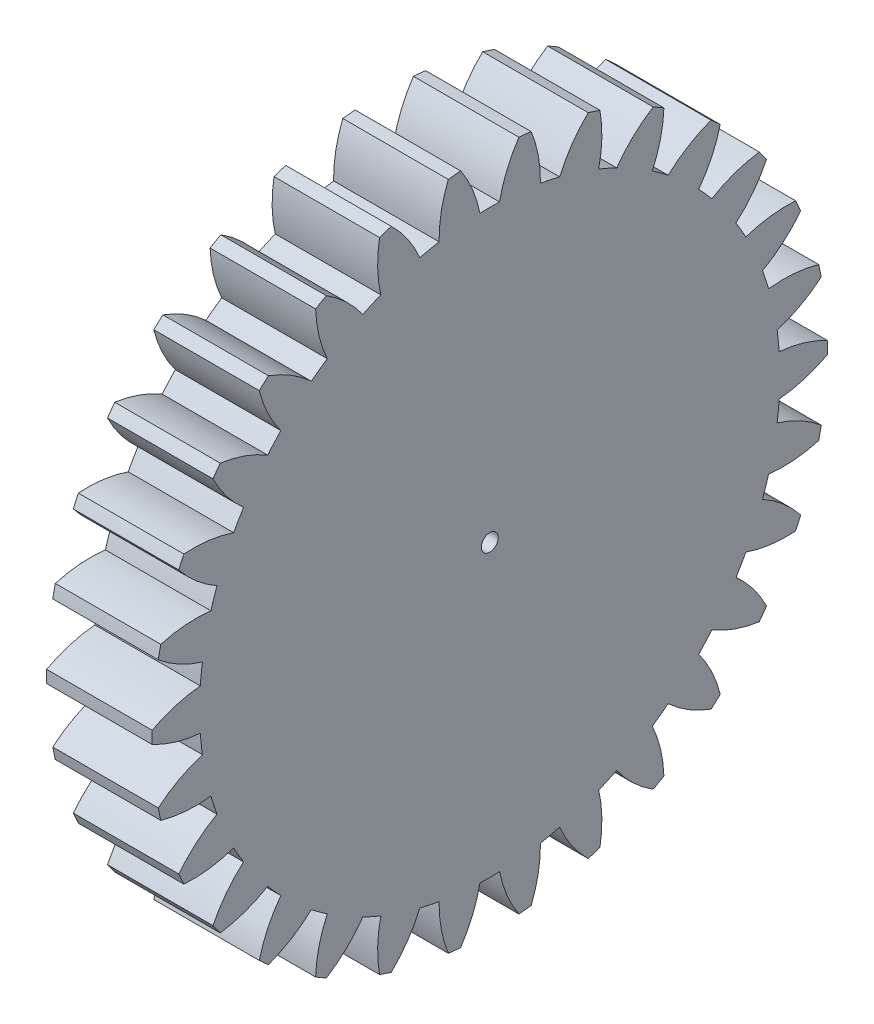
from build123d import *

# Parameters (mm, degrees)
BASPROSKE_W     = 5
BASPROSKE_H     = 16
TOOTHCUT_DEPTH  = 24.173260453
TEETHCUTS_COUNT = 30
TEETHCUTS_ANGLE = 348
BORSKE_R        = 0.4
BORE_DEPTH      = 50.0000508


with BuildPart() as part:
    # BasProSke → Base-Revolve (revolve)
    with BuildSketch(Plane(origin=(0, 0, 0), x_dir=(1, 0, 0), z_dir=(0, 1, 0)), mode=Mode.PRIVATE) as base_revolve_sk:
        with Locations((2.5, 8)):
            Rectangle(BASPROSKE_W, BASPROSKE_H)
    revolve(base_revolve_sk.sketch.rotate(Axis((-10, 0, 0), (1, 0, 0)), 180), axis=Axis((-10, 0, 0), (1, 0, 0)))

    # TooCutSke → ToothCut (cut, through all)
    with BuildSketch(Plane(origin=(0, 0, 0), x_dir=(0, 0, -1), z_dir=(1, 0, 0))):
        with BuildLine():
            ThreePointArc((0.466400716, 13.741086979), (0, 13.749), (-0.466400716, 13.741086979))
            ThreePointArc((-0.466400716, 13.741086979), (-0.819142092, 14.899954875), (-1.3974676, 15.964351834))
            ThreePointArc((-1.3974676, 15.964351834), (0, 16.0254), (1.3974676, 15.964351834))
            ThreePointArc((1.3974676, 15.964351834), (0.819142092, 14.899954875), (0.466400716, 13.741086979))
        make_face()
    toothcut = extrude(amount=TOOTHCUT_DEPTH, mode=Mode.SUBTRACT)

    # TeethCuts: ToothCut ×30 about axis
    teethcuts_axis = Axis((-10, 0, 0), (1, 0, 0))
    for i in range(1, TEETHCUTS_COUNT):
        add(toothcut.rotate(teethcuts_axis, i * TEETHCUTS_ANGLE / (TEETHCUTS_COUNT - 1)), mode=Mode.SUBTRACT)

    # BorSke → Bore (cut, symmetric)
    with BuildSketch(Plane(origin=(0, 0, 0), x_dir=(0, 0, -1), z_dir=(1, 0, 0))):
        with Locations(Location((0, 0, 0), (0, 0, 180))):
            Circle(BORSKE_R)
    extrude(amount=BORE_DEPTH, both=True, mode=Mode.SUBTRACT)


solid = part.part
